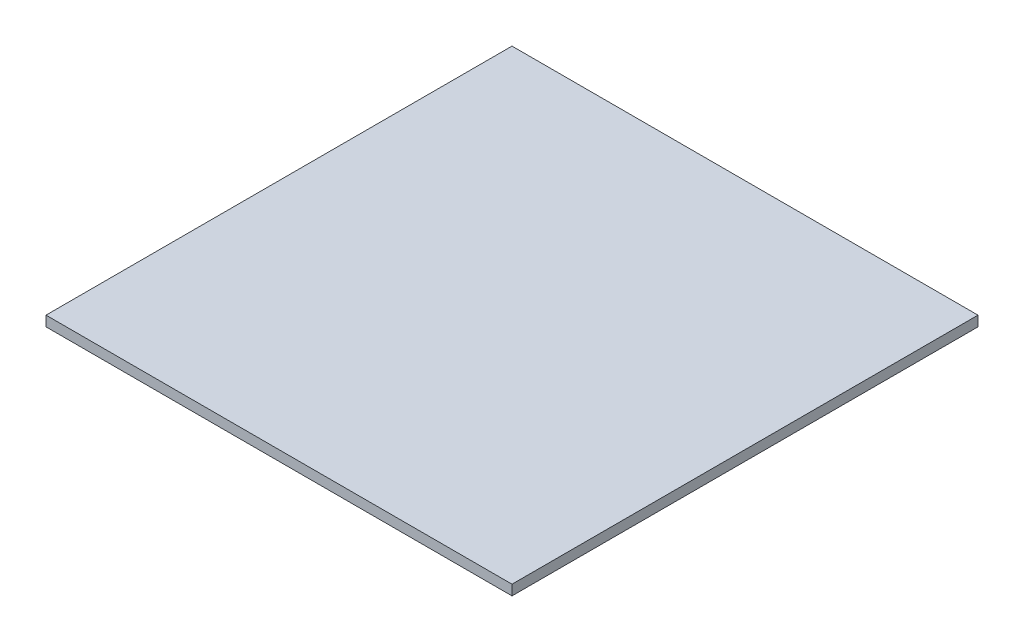
from build123d import *

# Parameters (mm, degrees)
SKETCH1_W           = 291.697589435
SKETCH1_H           = 291.687767563
BOSS_EXTRUDE1_DEPTH = 6.359632809


with BuildPart() as part:
    # Sketch1 → Boss-Extrude1 (new body)
    with BuildSketch(Plane(origin=(0, 0, 0), x_dir=(1, 0, 0), z_dir=(0, 1, 0))):
        with Locations((114.329766807, 114.207519995)):
            Rectangle(SKETCH1_W, SKETCH1_H)
    extrude(amount=BOSS_EXTRUDE1_DEPTH)


solid = part.part
